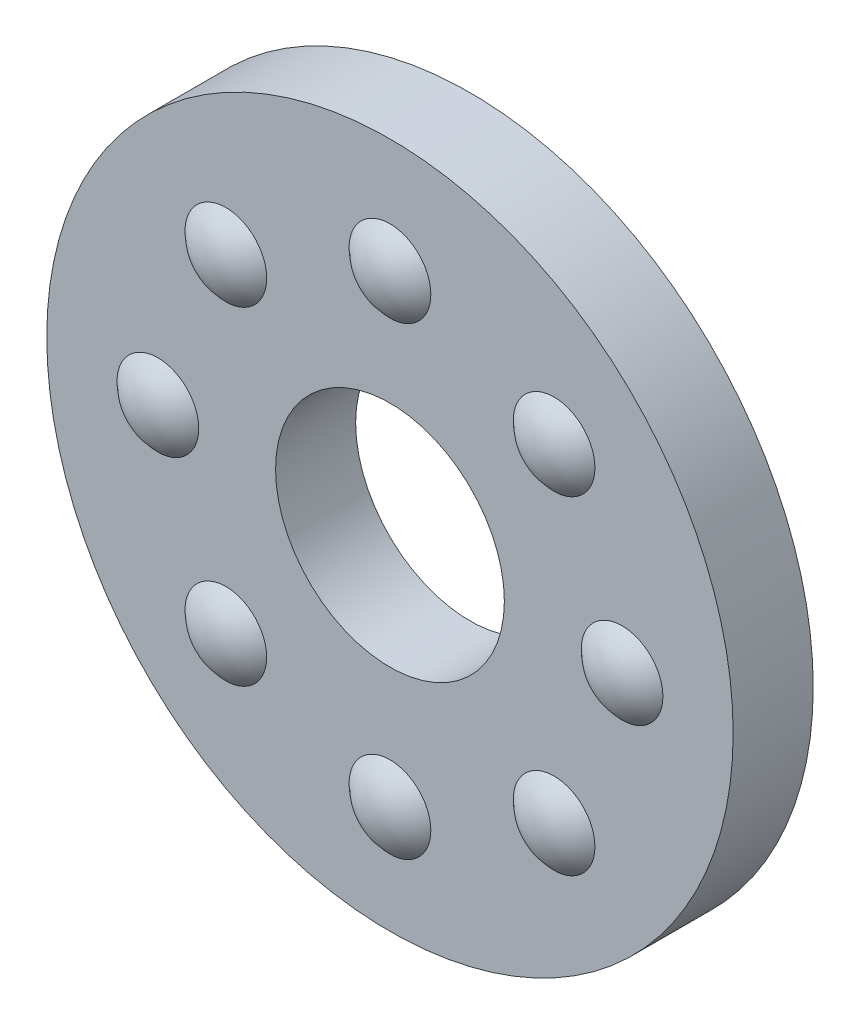
from build123d import *

# Parameters (mm, degrees)
SKETCH_1_R               = 3
EXTRUDE_1_DEPTH          = 0.7
PATTERN_CIRCULAR_1_COUNT = 8
SKETCH_3_R               = 1
CUT_EXTRUDE_1_DEPTH      = 5.326950427


with BuildPart() as part:
    # 草图1 → 凸台-拉伸1 (new body)
    with BuildSketch(Plane.XY):
        Circle(SKETCH_1_R)
    extrude(amount=EXTRUDE_1_DEPTH)

    # 草图2 → 旋转1 (revolve)
    with BuildSketch(Plane.XY.offset(0.35)):
        with BuildLine():
            Line((0, 2.5), (0, 1.5))
            ThreePointArc((0, 1.5), (-0.5, 2), (0, 2.5))
        make_face()
    revolve_1 = revolve(axis=Axis((0, 2.5, 0.35), (0, -1, 0)))

    # 阵列(圆周)1: 旋转1 ×8 about axis
    pattern_circular_1_axis = Axis((0, -0.02874049, 0), (0, 0, 1))
    for i in range(1, PATTERN_CIRCULAR_1_COUNT):
        add(revolve_1.rotate(pattern_circular_1_axis, i * 360 / PATTERN_CIRCULAR_1_COUNT))

    # 草图3 → 切除-拉伸1 (cut, through all)
    with BuildSketch(Plane.XY.offset(0.7)):
        Circle(SKETCH_3_R)
    extrude(amount=-CUT_EXTRUDE_1_DEPTH, mode=Mode.SUBTRACT)


solid = part.part
